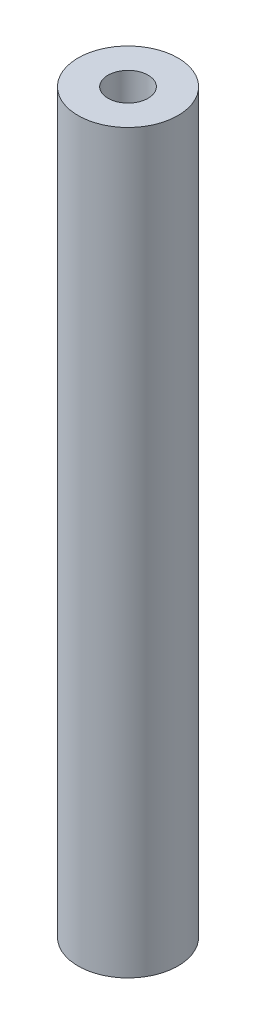
from build123d import *

# Parameters (mm, degrees)
SKETCH1_R                   = 6.35
BOSS_EXTRUDE1_DEPTH         = 93.6625
F_1_4_20_TAPPED_HOLE1_D     = 5.1054
F_1_4_20_TAPPED_HOLE1_DEPTH = 25.4
F_1_4_20_TAPPED_HOLE1_TIP   = 1.533816902
F_1_4_20_TAPPED_HOLE2_D     = 5.1054
F_1_4_20_TAPPED_HOLE2_DEPTH = 25.4
F_1_4_20_TAPPED_HOLE2_TIP   = 1.533816902


with BuildPart() as part:
    # Sketch1 → Boss-Extrude1 (new body)
    with BuildSketch(Plane(origin=(0, 0, 0), x_dir=(1, 0, 0), z_dir=(0, 1, 0))):
        with Locations(Location((0, 0, 0), (0, 0, 90))):
            Circle(SKETCH1_R)
    extrude(amount=BOSS_EXTRUDE1_DEPTH)

    # 1/4-20 Tapped Hole1
    with Locations(Plane(origin=(0, 93.6625, 0), x_dir=(1, 0, 0), z_dir=(0, 1, 0))):
        with Locations((0, 0)):
            Hole(F_1_4_20_TAPPED_HOLE1_D / 2, depth=F_1_4_20_TAPPED_HOLE1_DEPTH)
            with Locations((0, 0, -(F_1_4_20_TAPPED_HOLE1_DEPTH + F_1_4_20_TAPPED_HOLE1_TIP / 2))):  # 118° drill point
                Cone(0, F_1_4_20_TAPPED_HOLE1_D / 2, F_1_4_20_TAPPED_HOLE1_TIP, mode=Mode.SUBTRACT)

    # 1/4-20 Tapped Hole2
    with Locations(Plane(origin=(0, 0, 0), x_dir=(-1, 0, 0), z_dir=(0, -1, 0))):
        with Locations((0, 0)):
            Hole(F_1_4_20_TAPPED_HOLE2_D / 2, depth=F_1_4_20_TAPPED_HOLE2_DEPTH)
            with Locations((0, 0, -(F_1_4_20_TAPPED_HOLE2_DEPTH + F_1_4_20_TAPPED_HOLE2_TIP / 2))):  # 118° drill point
                Cone(0, F_1_4_20_TAPPED_HOLE2_D / 2, F_1_4_20_TAPPED_HOLE2_TIP, mode=Mode.SUBTRACT)


solid = part.part
